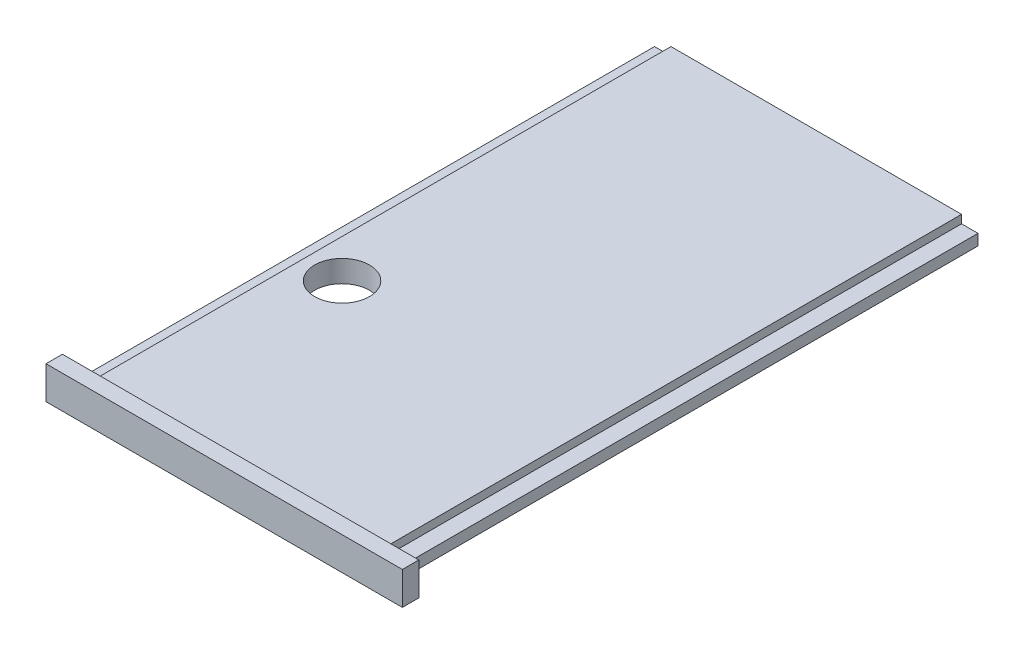
from build123d import *

# Parameters (mm, degrees)
SKETCH1_W           = 65
SKETCH1_H           = 6
BOSS_EXTRUDE1_DEPTH = 3
SKETCH2_W           = 53
SKETCH2_H           = 4
SKETCH2_W_2         = 3
SKETCH2_H_2         = 2
BOSS_EXTRUDE2_DEPTH = 105
SKETCH3_R           = 5
CUT_EXTRUDE1_DEPTH  = 98


with BuildPart() as part:
    # Sketch1 → Boss-Extrude1 (new body)
    with BuildSketch(Plane.XY):
        with Locations((32.5, 3)):
            Rectangle(SKETCH1_W, SKETCH1_H)
    extrude(amount=BOSS_EXTRUDE1_DEPTH)

    # Sketch2 → Boss-Extrude2 (add)
    with BuildSketch(Plane(origin=(0, 0, 0), x_dir=(-1, 0, 0), z_dir=(0, 0, -1))):
        with Locations((-32.5, 3.1)):
            Rectangle(SKETCH2_W, SKETCH2_H)
        with Locations((-60.5, 2.6)):
            Rectangle(SKETCH2_W_2, SKETCH2_H_2)
        with Locations((-4.5, 2.6)):
            Rectangle(SKETCH2_W_2, SKETCH2_H_2)
    extrude(amount=BOSS_EXTRUDE2_DEPTH)

    # Sketch3 → Cut-Extrude1 (cut)
    with BuildSketch(Plane(origin=(0, 5.1, 0), x_dir=(1, 0, 0), z_dir=(0, 1, 0))):
        with Locations(Location((13, 38, 0), (0, 0, 270))):
            Circle(SKETCH3_R)
    extrude(amount=-CUT_EXTRUDE1_DEPTH, mode=Mode.SUBTRACT)


solid = part.part
